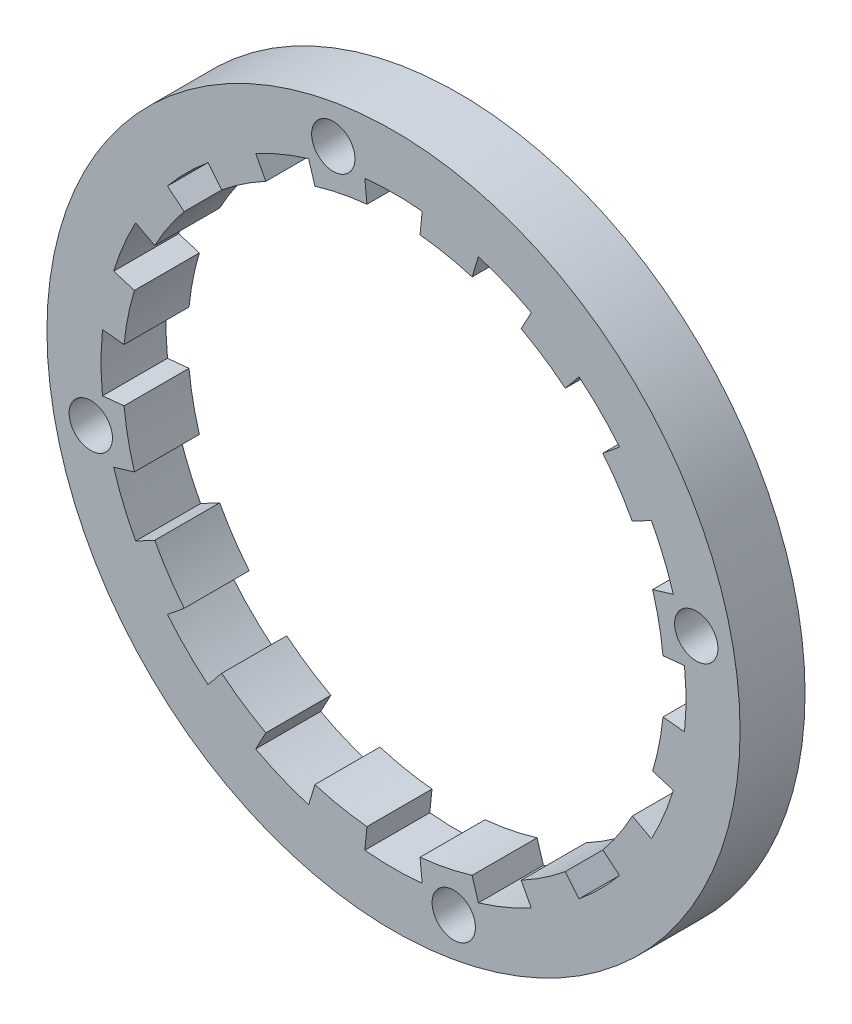
from build123d import *

# Parameters (mm, degrees)
ESBO_O1_R                = 32
RESSALTO_EXTRUS_O4_DEPTH = 6
ESBO_O2_R                = 2
CORTE_EXTRUS_O1_DEPTH    = 6


with BuildPart() as part:
    # Esboço1 → Ressalto-extrusão4 (new body)
    with BuildSketch(Plane.XY):
        Circle(ESBO_O1_R)
        with BuildLine():
            Line((-2.646462789, 26.86998762), (-2.450428508, 24.879618167))
            ThreePointArc((-2.450428508, 24.879618167), (-4.87725805, 24.51963201), (-7.257116931, 23.923508393))
            Line((-7.257116931, 23.923508393), (-7.837686286, 25.837389065))
            ThreePointArc((-7.837686286, 25.837389065), (-9.096026042, 25.42168976), (-10.332452674, 24.944747378))
            ThreePointArc((-10.332452674, 24.944747378), (-11.543987523, 24.407710914), (-12.727711894, 23.811874137))
            Line((-12.727711894, 23.811874137), (-11.784918421, 22.048031609))
            ThreePointArc((-11.784918421, 22.048031609), (-13.889255825, 20.786740308), (-15.859832104, 19.325261334))
            Line((-15.859832104, 19.325261334), (-17.128618672, 20.871282241))
            ThreePointArc((-17.128618672, 20.871282241), (-18.132091781, 20.005680385), (-19.091883092, 19.091883092))
            ThreePointArc((-19.091883092, 19.091883092), (-20.005680385, 18.132091781), (-20.871282241, 17.128618672))
            Line((-20.871282241, 17.128618672), (-19.325261334, 15.859832104))
            ThreePointArc((-19.325261334, 15.859832104), (-20.786740308, 13.889255825), (-22.048031609, 11.784918421))
            Line((-22.048031609, 11.784918421), (-23.811874137, 12.727711894))
            ThreePointArc((-23.811874137, 12.727711894), (-24.407710914, 11.543987523), (-24.944747378, 10.332452674))
            ThreePointArc((-24.944747378, 10.332452674), (-25.42168976, 9.096026042), (-25.837389065, 7.837686286))
            Line((-25.837389065, 7.837686286), (-23.923508393, 7.257116931))
            ThreePointArc((-23.923508393, 7.257116931), (-24.51963201, 4.87725805), (-24.879618167, 2.450428508))
            Line((-24.879618167, 2.450428508), (-26.86998762, 2.646462789))
            ThreePointArc((-26.86998762, 2.646462789), (-26.967477318, 1.324827207), (-27, 0))
            ThreePointArc((-27, 0), (-26.967477318, -1.324827207), (-26.86998762, -2.646462789))
            Line((-26.86998762, -2.646462789), (-24.879618167, -2.450428508))
            ThreePointArc((-24.879618167, -2.450428508), (-24.51963201, -4.87725805), (-23.923508393, -7.257116931))
            Line((-23.923508393, -7.257116931), (-25.837389065, -7.837686286))
            ThreePointArc((-25.837389065, -7.837686286), (-25.42168976, -9.096026042), (-24.944747378, -10.332452674))
            ThreePointArc((-24.944747378, -10.332452674), (-24.407710914, -11.543987523), (-23.811874137, -12.727711894))
            Line((-23.811874137, -12.727711894), (-22.048031609, -11.784918421))
            ThreePointArc((-22.048031609, -11.784918421), (-20.786740308, -13.889255825), (-19.325261334, -15.859832104))
            Line((-19.325261334, -15.859832104), (-20.871282241, -17.128618672))
            ThreePointArc((-20.871282241, -17.128618672), (-20.005680385, -18.132091781), (-19.091883092, -19.091883092))
            ThreePointArc((-19.091883092, -19.091883092), (-18.132091781, -20.005680385), (-17.128618672, -20.871282241))
            Line((-17.128618672, -20.871282241), (-15.859832104, -19.325261334))
            ThreePointArc((-15.859832104, -19.325261334), (-13.889255825, -20.786740308), (-11.784918421, -22.048031609))
            Line((-11.784918421, -22.048031609), (-12.727711894, -23.811874137))
            ThreePointArc((-12.727711894, -23.811874137), (-11.543987523, -24.407710914), (-10.332452674, -24.944747378))
            ThreePointArc((-10.332452674, -24.944747378), (-9.096026042, -25.42168976), (-7.837686286, -25.837389065))
            Line((-7.837686286, -25.837389065), (-7.257116931, -23.923508393))
            ThreePointArc((-7.257116931, -23.923508393), (-4.87725805, -24.51963201), (-2.450428508, -24.879618167))
            Line((-2.450428508, -24.879618167), (-2.646462789, -26.86998762))
            ThreePointArc((-2.646462789, -26.86998762), (-1.324827207, -26.967477318), (0, -27))
            ThreePointArc((0, -27), (1.324827207, -26.967477318), (2.646462789, -26.86998762))
            Line((2.646462789, -26.86998762), (2.450428508, -24.879618167))
            ThreePointArc((2.450428508, -24.879618167), (4.87725805, -24.51963201), (7.257116931, -23.923508393))
            Line((7.257116931, -23.923508393), (7.837686286, -25.837389065))
            ThreePointArc((7.837686286, -25.837389065), (9.096026042, -25.42168976), (10.332452674, -24.944747378))
            ThreePointArc((10.332452674, -24.944747378), (11.543987523, -24.407710914), (12.727711894, -23.811874137))
            Line((12.727711894, -23.811874137), (11.784918421, -22.048031609))
            ThreePointArc((11.784918421, -22.048031609), (13.889255825, -20.786740308), (15.859832104, -19.325261334))
            Line((15.859832104, -19.325261334), (17.128618672, -20.871282241))
            ThreePointArc((17.128618672, -20.871282241), (18.132091781, -20.005680385), (19.091883092, -19.091883092))
            ThreePointArc((19.091883092, -19.091883092), (20.005680385, -18.132091781), (20.871282241, -17.128618672))
            Line((20.871282241, -17.128618672), (19.325261334, -15.859832104))
            ThreePointArc((19.325261334, -15.859832104), (20.786740308, -13.889255825), (22.048031609, -11.784918421))
            Line((22.048031609, -11.784918421), (23.811874137, -12.727711894))
            ThreePointArc((23.811874137, -12.727711894), (24.407710914, -11.543987523), (24.944747378, -10.332452674))
            ThreePointArc((24.944747378, -10.332452674), (25.42168976, -9.096026042), (25.837389065, -7.837686286))
            Line((25.837389065, -7.837686286), (23.923508393, -7.257116931))
            ThreePointArc((23.923508393, -7.257116931), (24.51963201, -4.87725805), (24.879618167, -2.450428508))
            Line((24.879618167, -2.450428508), (26.86998762, -2.646462789))
            ThreePointArc((26.86998762, -2.646462789), (26.967477318, -1.324827207), (27, 0))
            ThreePointArc((27, 0), (26.967477318, 1.324827207), (26.86998762, 2.646462789))
            Line((26.86998762, 2.646462789), (24.879618167, 2.450428508))
            ThreePointArc((24.879618167, 2.450428508), (24.51963201, 4.87725805), (23.923508393, 7.257116931))
            Line((23.923508393, 7.257116931), (25.837389065, 7.837686286))
            ThreePointArc((25.837389065, 7.837686286), (25.42168976, 9.096026042), (24.944747378, 10.332452674))
            ThreePointArc((24.944747378, 10.332452674), (24.407710914, 11.543987523), (23.811874137, 12.727711894))
            Line((23.811874137, 12.727711894), (22.048031609, 11.784918421))
            ThreePointArc((22.048031609, 11.784918421), (20.786740308, 13.889255825), (19.325261334, 15.859832104))
            Line((19.325261334, 15.859832104), (20.871282241, 17.128618672))
            ThreePointArc((20.871282241, 17.128618672), (20.005680385, 18.132091781), (19.091883092, 19.091883092))
            ThreePointArc((19.091883092, 19.091883092), (18.132091781, 20.005680385), (17.128618672, 20.871282241))
            Line((17.128618672, 20.871282241), (15.859832104, 19.325261334))
            ThreePointArc((15.859832104, 19.325261334), (13.889255825, 20.786740308), (11.784918421, 22.048031609))
            Line((11.784918421, 22.048031609), (12.727711894, 23.811874137))
            ThreePointArc((12.727711894, 23.811874137), (11.543987523, 24.407710914), (10.332452674, 24.944747378))
            ThreePointArc((10.332452674, 24.944747378), (9.096026042, 25.42168976), (7.837686286, 25.837389065))
            Line((7.837686286, 25.837389065), (7.257116931, 23.923508393))
            ThreePointArc((7.257116931, 23.923508393), (4.87725805, 24.51963201), (2.450428508, 24.879618167))
            Line((2.450428508, 24.879618167), (2.646462789, 26.86998762))
            ThreePointArc((2.646462789, 26.86998762), (1.324827207, 26.967477318), (0, 27))
            ThreePointArc((0, 27), (-1.324827207, 26.967477318), (-2.646462789, 26.86998762))
        make_face(mode=Mode.SUBTRACT)
    extrude(amount=RESSALTO_EXTRUS_O4_DEPTH)

    # Esboço2 → Corte-extrusão1 (cut)
    with BuildSketch(Plane.XY.offset(6)):
        with Locations((-5.560074177, 27.952380491)):
            Circle(ESBO_O2_R)
        with Locations((5.560074177, -27.952380491)):
            Circle(ESBO_O2_R)
        with Locations((27.952380491, 5.560074177)):
            Circle(ESBO_O2_R)
        with Locations((-27.952380491, -5.560074177)):
            Circle(ESBO_O2_R)
    extrude(amount=-CORTE_EXTRUS_O1_DEPTH, mode=Mode.SUBTRACT)


solid = part.part
